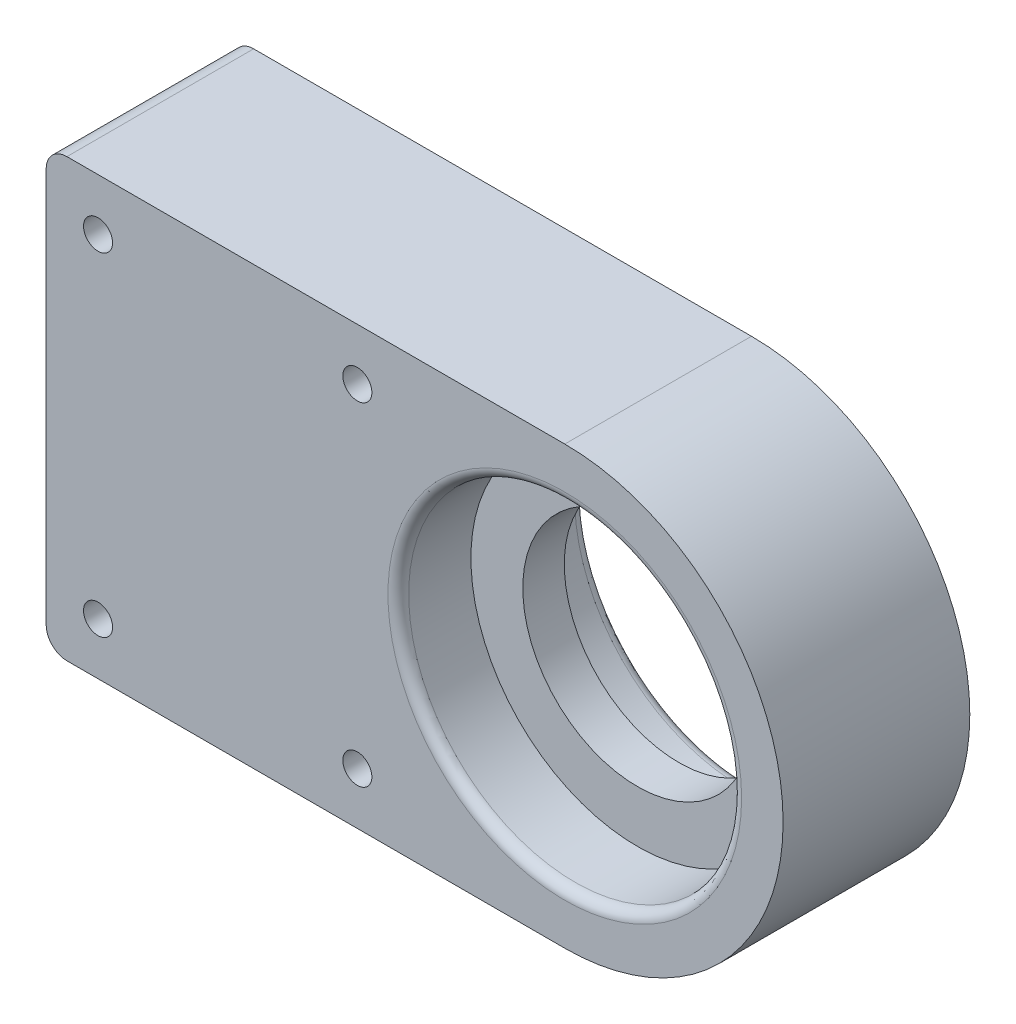
from build123d import *

# Parameters (mm, degrees)
BOSS_EXTRUDE1_DEPTH      = 9
BOSS_EXTRUDE1_DEPTH_BACK = 9
SKETCH1_R                = 16.05
BOSS_EXTRUDE2_DEPTH      = 2
BOSS_EXTRUDE2_DEPTH_BACK = 2
SKETCH2_R                = 11.05
SKETCH3_R                = 1.4
CUT_EXTRUDE1_DEPTH       = 58.158573285
FILLET1_R                = 2
FILLET2_R                = 1


with BuildPart() as part:
    # Sketch1 → Boss-Extrude1 (new, two sides: drawn at the far end of the back side and taken through both)
    with BuildSketch(Plane.XY.offset(-BOSS_EXTRUDE1_DEPTH_BACK)):
        with BuildLine():
            Line((0, 21.05), (-50, 21.05))
            Line((-50, 21.05), (-50, -21.05))
            Line((-50, -21.05), (0, -21.05))
            ThreePointArc((0, -21.05), (21.05, 0), (0, 21.05))
        make_face()
        Circle(SKETCH1_R, mode=Mode.SUBTRACT)
    extrude(amount=BOSS_EXTRUDE1_DEPTH + BOSS_EXTRUDE1_DEPTH_BACK)

    # Sketch2 → Boss-Extrude2 (add, two sides: drawn at the far end of the back side and taken through both)
    with BuildSketch(Plane(origin=(0, 0, 0), x_dir=(-1, 0, 0), z_dir=(0, 0, -1)).offset(-BOSS_EXTRUDE2_DEPTH_BACK)):
        with BuildLine():
            Line((0, -21.05), (50, -21.05))
            Line((50, -21.05), (50, 21.05))
            Line((50, 21.05), (0, 21.05))
            ThreePointArc((0, 21.05), (-21.05, 0), (0, -21.05))
        make_face()
        with Locations(Location((0, 0, 0), (0, 0, 180))):
            Circle(SKETCH2_R, mode=Mode.SUBTRACT)
    extrude(amount=BOSS_EXTRUDE2_DEPTH + BOSS_EXTRUDE2_DEPTH_BACK)

    # Sketch3 → Cut-Extrude1 (cut, through all)
    with BuildSketch(Plane.XY.offset(9)):
        with Locations((-45, 16.05)):
            Circle(SKETCH3_R)
        with Locations((-20, 16.05)):
            Circle(SKETCH3_R)
        with Locations((-20, -16.05)):
            Circle(SKETCH3_R)
        with Locations((-45, -16.05)):
            Circle(SKETCH3_R)
    extrude(amount=-CUT_EXTRUDE1_DEPTH, mode=Mode.SUBTRACT)

    # Fillet1
    fillet1_edges = [part.edges().sort_by_distance(p)[0] for p in [
        (-50, -21.05, 0),
        (-50, 21.05, 0),
    ]]
    fillet(fillet1_edges, radius=FILLET1_R)

    # Fillet2
    fillet2_edges = [part.edges().sort_by_distance(p)[0] for p in [
        (-16.05, 0, -9),
        (-16.05, 0, 9),
    ]]
    fillet(fillet2_edges, radius=FILLET2_R)


solid = part.part
